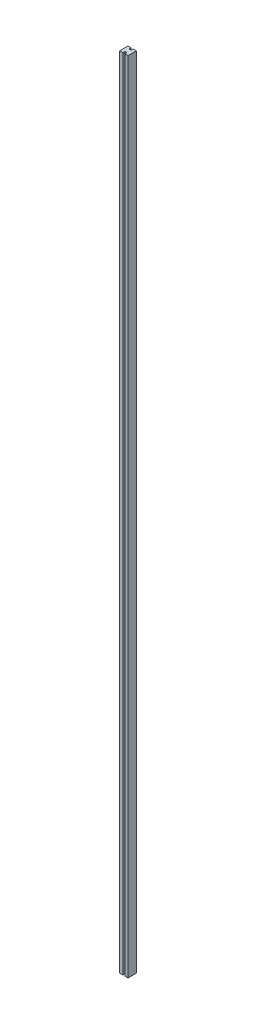
from build123d import *

# Parameters (mm, degrees)
SALIENTE_EXTRUIR1_DEPTH = 975


with BuildPart() as part:
    # Croquis1 → Saliente-Extruir1 (new, symmetric)
    with BuildSketch(Plane(origin=(0, 0, 0), x_dir=(1, 0, 0), z_dir=(0, 1, 0))):
        Polygon((0, 0), (7.65, 0), (7.65, -5), (12.65, -5), (12.65, 0), (20.3, 0), (20.3, -20.3), (12.65, -20.3), (12.65, -15.3), (7.65, -15.3), (7.65, -20.3), (0, -20.3), align=None)
    extrude(amount=SALIENTE_EXTRUIR1_DEPTH, both=True)


solid = part.part
